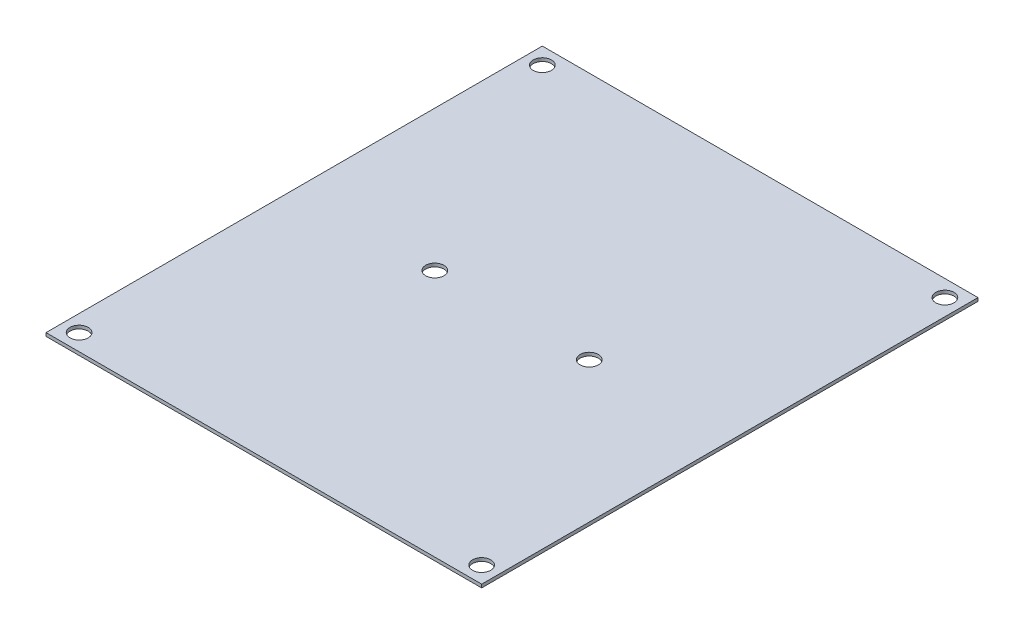
from build123d import *

# Parameters (mm, degrees)
SKETCH1_W           = 79
SKETCH1_H           = 90
BOSS_EXTRUDE1_DEPTH = 0.6
SKETCH2_R           = 1.65
CUT_EXTRUDE1_DEPTH  = 120.755417414


with BuildPart() as part:
    # Sketch1 → Boss-Extrude1 (new body)
    with BuildSketch(Plane(origin=(0, 0, 0), x_dir=(1, 0, 0), z_dir=(0, 1, 0))):
        with Locations((39.5, 45)):
            Rectangle(SKETCH1_W, SKETCH1_H)
    extrude(amount=BOSS_EXTRUDE1_DEPTH)

    # Sketch2 → Cut-Extrude1 (cut, through all)
    with BuildSketch(Plane(origin=(0, 0.6, 0), x_dir=(1, 0, 0), z_dir=(0, 1, 0))):
        with Locations(Location((3, 87, 0), (0, 0, 270))):
            Circle(SKETCH2_R)
        with Locations(Location((76, 87, 0), (0, 0, 270))):
            Circle(SKETCH2_R)
        with Locations(Location((53.5, 45, 0), (0, 0, 270))):
            Circle(SKETCH2_R)
        with Locations(Location((25.5, 45, 0), (0, 0, 270))):
            Circle(SKETCH2_R)
        with Locations(Location((76, 3, 0), (0, 0, 270))):
            Circle(SKETCH2_R)
        with Locations(Location((3, 3, 0), (0, 0, 270))):
            Circle(SKETCH2_R)
    extrude(amount=-CUT_EXTRUDE1_DEPTH, mode=Mode.SUBTRACT)


solid = part.part
